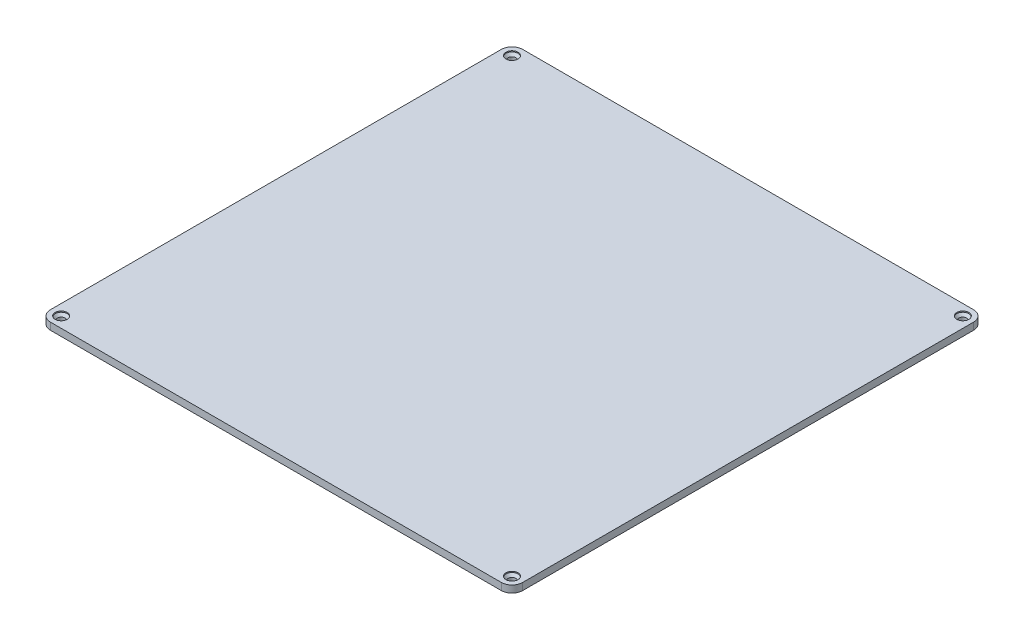
from build123d import *

# Parameters (mm, degrees)
SKETCH1_W            = 220
SKETCH1_H            = 220
EXTRUDE1_DEPTH       = 3.3
FILLET1_R            = 5
SKETCH2_R            = 1.75
EXTRUDE2_DEPTH       = 3.3
LPATTERN1_COUNT      = 2
LPATTERN1_PITCH      = 210
LPATTERN1_COUNT_DIR2 = 2
LPATTERN1_PITCH_DIR2 = 210


with BuildPart() as part:
    # Sketch1 → Extrude1 (new body)
    with BuildSketch(Plane(origin=(0, 0, 0), x_dir=(1, 0, 0), z_dir=(0, 1, 0))):
        Rectangle(SKETCH1_W, SKETCH1_H)
    extrude(amount=EXTRUDE1_DEPTH)

    # Fillet1
    fillet1_edges = [part.edges().sort_by_distance(p)[0] for p in [
        (-110, 1.65, -110),
        (110, 1.65, -110),
        (110, 1.65, 110),
        (-110, 1.65, 110),
    ]]
    fillet(fillet1_edges, radius=FILLET1_R)

    # Sketch2 → Extrude2 (cut)
    with BuildSketch(Plane(origin=(0, 3.3, 0), x_dir=(1, 0, 0), z_dir=(0, 1, 0))):
        with Locations(Location((-105, 105, 0), (0, 0, 270))):
            Circle(SKETCH2_R)
        with Locations(Location((105, 105, 0), (0, 0, 270))):
            Circle(SKETCH2_R)
        with Locations(Location((-105, -105, 0), (0, 0, 270))):
            Circle(SKETCH2_R)
        with Locations(Location((105, -105, 0), (0, 0, 270))):
            Circle(SKETCH2_R)
    extrude(amount=-EXTRUDE2_DEPTH, mode=Mode.SUBTRACT)

    # Sketch3 → Cut-Revolve1 (revolve, cut)
    with BuildSketch(Plane(origin=(0, 0, -105), x_dir=(-1, 0, 0), z_dir=(0, 0, -1)), mode=Mode.PRIVATE) as cut_revolve1_sk:
        Polygon((105, 3.3), (107.8, 3.3), (107.8, 2.8), (106.5, 1.3), (105, 1.3), align=None)
    cut_revolve1 = revolve(cut_revolve1_sk.sketch.rotate(Axis((-105, 1.3, -105), (0, 1, 0)), 90), axis=Axis((-105, 1.3, -105), (0, 1, 0)), mode=Mode.SUBTRACT)

    # LPattern1: Cut-Revolve1 2 × 2
    with Locations(*[(i * LPATTERN1_PITCH, 0, j * LPATTERN1_PITCH_DIR2) for i in range(LPATTERN1_COUNT) for j in range(LPATTERN1_COUNT_DIR2) if (i, j) != (0, 0)]):
        add(cut_revolve1, mode=Mode.SUBTRACT)


solid = part.part
